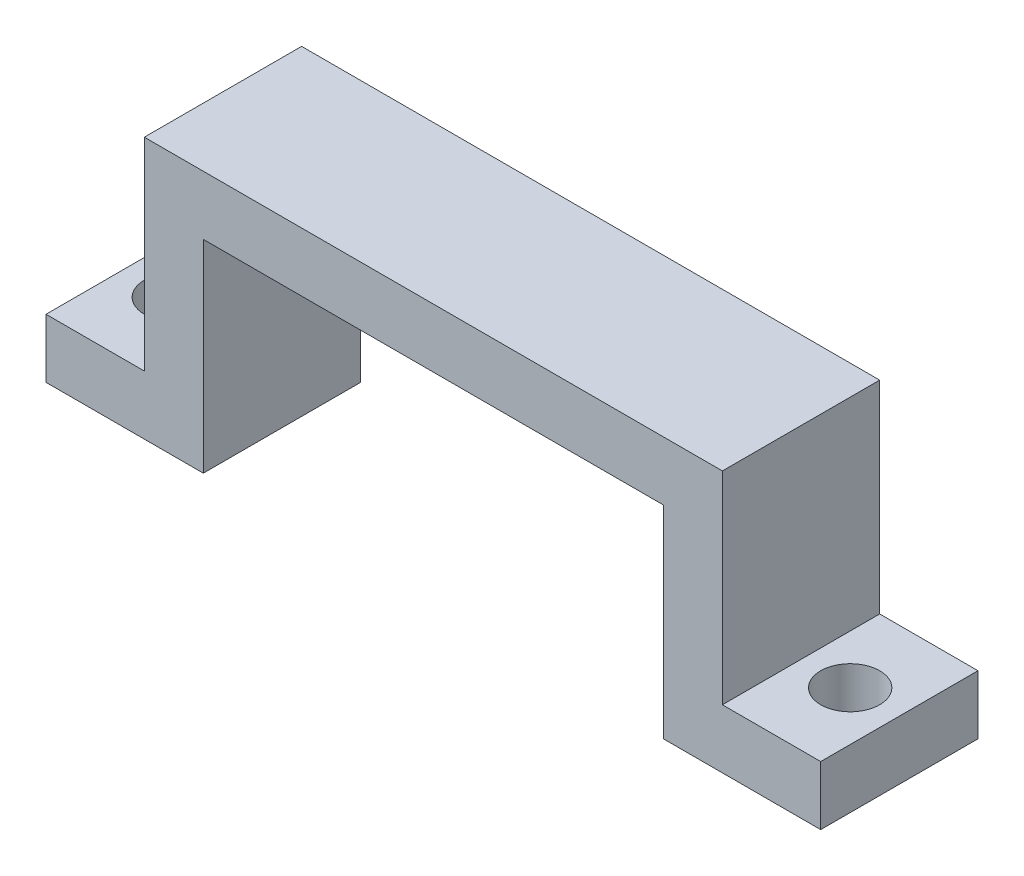
from build123d import *

# Parameters (mm, degrees)
SKETCH1_W           = 29.4
SKETCH1_H           = 8
BOSS_EXTRUDE1_DEPTH = 13.3
CUT_EXTRUDE2_REACH  = 23.377
SKETCH4_W           = 23.4
SKETCH4_H           = 10.3
SKETCH5_W           = 8
SKETCH5_H           = 3
BOSS_EXTRUDE3_DEPTH = 5
CUT_EXTRUDE3_REACH  = 24.587
SKETCH6_R           = 1.5


with BuildPart() as part:
    # Sketch1 → Boss-Extrude1 (new body)
    with BuildSketch(Plane(origin=(0, 0, 0), x_dir=(1, 0, 0), z_dir=(0, 1, 0))):
        Rectangle(SKETCH1_W, SKETCH1_H)
    extrude(amount=-BOSS_EXTRUDE1_DEPTH)

    # Sketch4 → Cut-Extrude2 (cut, up to next)
    with BuildSketch(Plane.XY.offset(4), mode=Mode.PRIVATE) as cut_extrude2_sk1:
        with Locations((0, -8.15)):
            Rectangle(SKETCH4_W, SKETCH4_H)
    cut_extrude2_tool1 = extrude(cut_extrude2_sk1.sketch, amount=-CUT_EXTRUDE2_REACH, mode=Mode.PRIVATE) & part.part
    add(cut_extrude2_tool1.solids().sort_by_distance((0, -8.15, 4))[0], mode=Mode.SUBTRACT)

    # Sketch5 → Boss-Extrude3 (add)
    with BuildSketch(Plane(origin=(14.7, 0, 0), x_dir=(0, 0, -1), z_dir=(1, 0, 0))):
        with Locations((0, -11.8)):
            Rectangle(SKETCH5_W, SKETCH5_H)
    boss_extrude3 = extrude(amount=BOSS_EXTRUDE3_DEPTH)

    # Sketch6 → Cut-Extrude3 (cut, up to next)
    with BuildSketch(Plane(origin=(0, -10.3, 0), x_dir=(1, 0, 0), z_dir=(0, 1, 0)), mode=Mode.PRIVATE) as cut_extrude3_sk1:
        with Locations(Location((17.2, 0, 0), (0, 0, 270))):
            Circle(SKETCH6_R)
    cut_extrude3_tool1 = extrude(cut_extrude3_sk1.sketch, amount=-CUT_EXTRUDE3_REACH, mode=Mode.PRIVATE) & part.part
    cut_extrude3 = cut_extrude3_tool1.solids().sort_by_distance((17.2, -10.3, 0))[0]
    add(cut_extrude3, mode=Mode.SUBTRACT)

    # Mirror2: Boss-Extrude3, Cut-Extrude3 across plane
    add(boss_extrude3.mirror(Plane(origin=(0, 0, 0), x_dir=(0, 0, 1), z_dir=(1, 0, 0))))
    add(cut_extrude3.mirror(Plane(origin=(0, 0, 0), x_dir=(0, 0, 1), z_dir=(1, 0, 0))), mode=Mode.SUBTRACT)


solid = part.part
